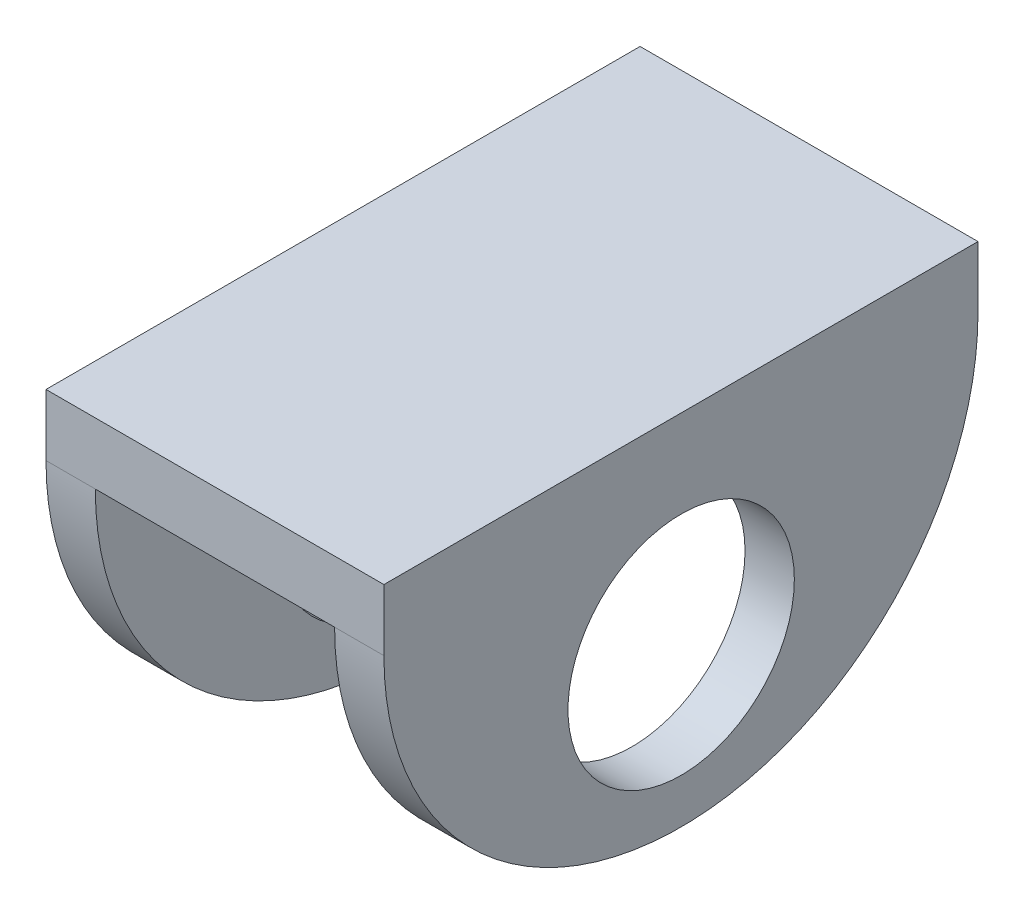
from build123d import *

# Parameters (mm, degrees)
BOSS_EXTRUDE1_DEPTH      = 20.832572
BOSS_EXTRUDE1_DEPTH_BACK = 20.832572
SKETCH1_W                = 103.439976
SKETCH1_H                = 10.722102
SKETCH2_R                = 19.704892681
BOSS_EXTRUDE2_DEPTH      = 8.586216


with BuildPart() as part:
    # Sketch1 → Boss-Extrude1 (new, two sides: drawn at the far end of the back side and taken through both)
    with BuildSketch(Plane(origin=(0, 0, 0), x_dir=(0, 0, -1), z_dir=(1, 0, 0)).offset(-BOSS_EXTRUDE1_DEPTH_BACK)):
        with Locations((185.773568, 570.773433)):
            Rectangle(SKETCH1_W, SKETCH1_H)
    extrude(amount=BOSS_EXTRUDE1_DEPTH + BOSS_EXTRUDE1_DEPTH_BACK)

    # Sketch2 → Boss-Extrude2 (add)
    with BuildSketch(Plane(origin=(20.832572, 0, 0), x_dir=(0, 0, -1), z_dir=(1, 0, 0))):
        with BuildLine():
            Line((134.05358, 565.412382), (134.05358, 576.134484))
            Line((134.05358, 576.134484), (237.493556, 576.134484))
            Line((237.493556, 576.134484), (237.493556, 565.412382))
            ThreePointArc((237.493556, 565.412382), (185.773568, 513.692394), (134.05358, 565.412382))
        make_face()
        with Locations((185.811668, 541.18891)):
            Circle(SKETCH2_R, mode=Mode.SUBTRACT)
    boss_extrude2 = extrude(amount=BOSS_EXTRUDE2_DEPTH)

    # Mirror1: Boss-Extrude2 across plane
    add(boss_extrude2.mirror(Plane(origin=(0, 0, 0), x_dir=(0, 0, 1), z_dir=(1, 0, 0))))


solid = part.part
